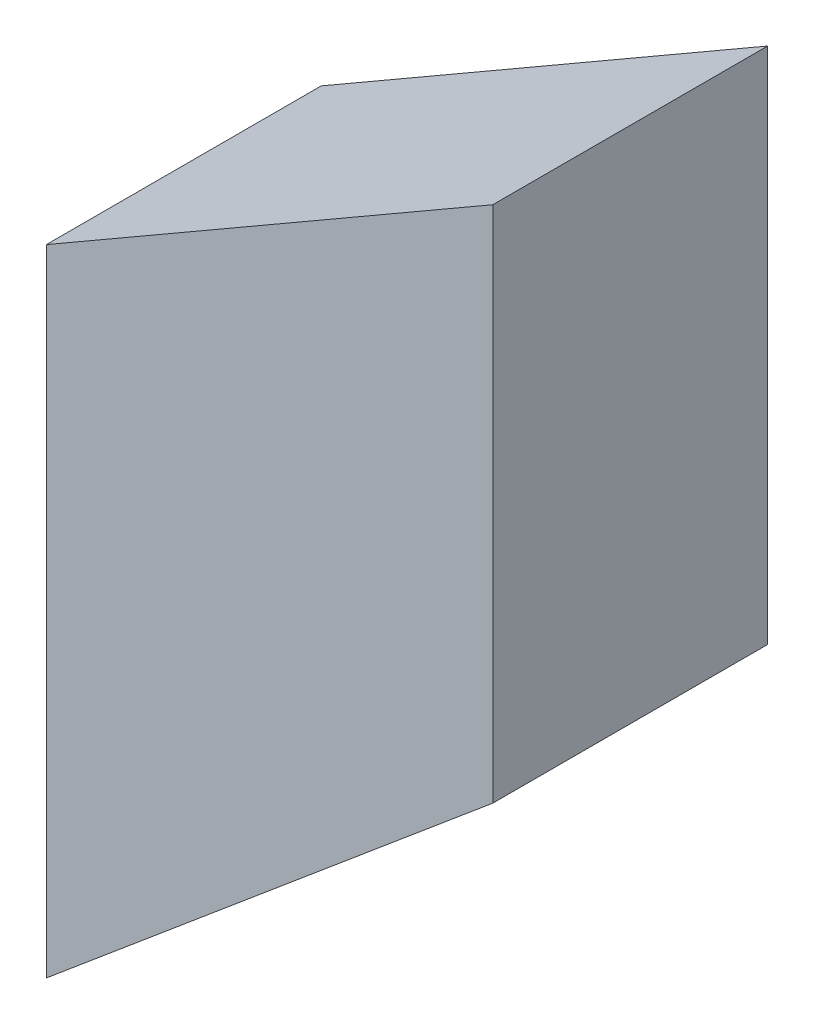
from build123d import *

# Parameters (mm, degrees)
BOSS_EXTRUDE1_DEPTH = 18769.584


with BuildPart() as part:
    # Sketch1 → Boss-Extrude1 (new body)
    with BuildSketch(Plane.XY):
        Polygon((0, 25575.756758283), (0, 60960), (-30480, 43362.3637951), (-30480, 0), align=None)
    extrude(amount=-BOSS_EXTRUDE1_DEPTH)


solid = part.part
